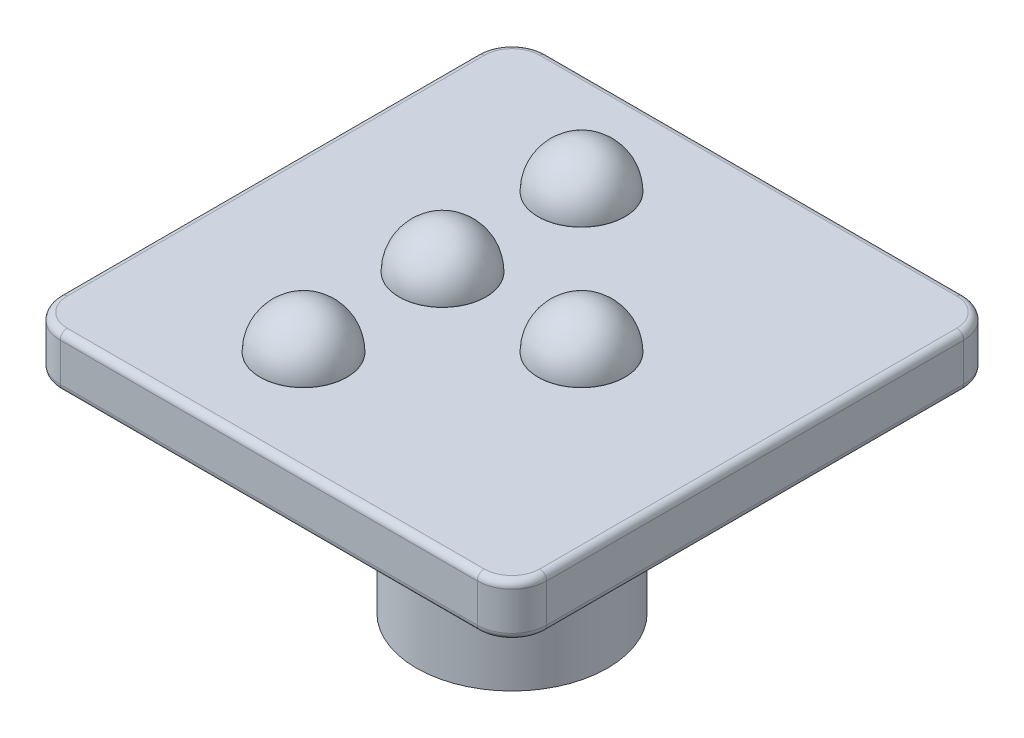
from build123d import *

# Parameters (mm, degrees)
BOSS_EXTRUDE1_DEPTH = 1.5
SKETCH2_R           = 2.75
BOSS_EXTRUDE2_DEPTH = 6
SKETCH3_W           = 1.1
SKETCH3_H           = 1.45
SKETCH3_W_2         = 1.45
SKETCH3_H_2         = 1.1
CUT_EXTRUDE1_DEPTH  = 6
CHAMFER1_SIZE       = 0.3
FILLET1_R           = 1
SKETCH4_R           = 1.25
BOSS_EXTRUDE3_DEPTH = 0.01
DOME1_FACE_RADIUS   = 1.25
DOME1_HEIGHT        = 1.25
DOME3_FACE_RADIUS   = 1.25
DOME3_HEIGHT        = 1.25
DOME4_FACE_RADIUS   = 1.25
DOME4_HEIGHT        = 1.25
DOME5_FACE_RADIUS   = 1.25
DOME5_HEIGHT        = 1.25
FILLET3_R           = 0.2


with BuildPart() as part:
    # Sketch1 → Boss-Extrude1 (new body)
    with BuildSketch(Plane(origin=(0, 0, 0), x_dir=(1, 0, 0), z_dir=(0, 1, 0))):
        with BuildLine():
            Line((-7.324675649, 4.396717546), (4.675324351, 4.396717546))
            ThreePointArc((4.675324351, 4.396717546), (5.382431132, 4.103824327), (5.675324351, 3.396717546))
            Line((5.675324351, 3.396717546), (5.675324351, -8.603282454))
            ThreePointArc((5.675324351, -8.603282454), (5.382431132, -9.310389235), (4.675324351, -9.603282454))
            Line((4.675324351, -9.603282454), (-7.324675649, -9.603282454))
            ThreePointArc((-7.324675649, -9.603282454), (-8.03178243, -9.310389235), (-8.324675649, -8.603282454))
            Line((-8.324675649, -8.603282454), (-8.324675649, 3.396717546))
            ThreePointArc((-8.324675649, 3.396717546), (-8.03178243, 4.103824327), (-7.324675649, 4.396717546))
        make_face()
    extrude(amount=BOSS_EXTRUDE1_DEPTH)

    # Sketch2 → Boss-Extrude2 (add)
    with BuildSketch(Plane.XZ):
        with Locations(Location((-1.324675649, 2.603282454, 0), (0, 0, 270))):
            Circle(SKETCH2_R)
    extrude(amount=BOSS_EXTRUDE2_DEPTH)

    # Sketch3 → Cut-Extrude1 (cut)
    with BuildSketch(Plane.XZ.offset(6)):
        with Locations((-1.324675649, 3.878282454)):
            Rectangle(SKETCH3_W, SKETCH3_H)
        with Locations((-0.049675649, 2.603282454)):
            Rectangle(SKETCH3_W_2, SKETCH3_H_2)
        with Locations((-1.324675649, 2.603282454)):
            Rectangle(SKETCH3_W, SKETCH3_H_2)
        with Locations((-2.599675649, 2.603282454)):
            Rectangle(SKETCH3_W_2, SKETCH3_H_2)
        with Locations((-1.324675649, 1.328282454)):
            Rectangle(SKETCH3_W, SKETCH3_H)
    extrude(amount=-CUT_EXTRUDE1_DEPTH, mode=Mode.SUBTRACT)

    # Chamfer1
    chamfer1_edges = [part.edges().sort_by_distance(p)[0] for p in [
        (-0.774675649, -6, 3.878282454),
        (-0.049675649, -6, 3.153282454),
        (0.675324351, -6, 2.603282454),
        (-0.774675649, -6, 1.328282454),
        (-2.599675649, -6, 3.153282454),
        (-1.324675649, -6, 4.603282454),
        (-1.874675649, -6, 3.878282454),
        (-3.324675649, -6, 2.603282454),
        (-2.599675649, -6, 2.053282454),
        (-1.874675649, -6, 1.328282454),
        (-1.324675649, -6, 0.603282454),
        (-0.049675649, -6, 2.053282454),
    ]]
    chamfer(chamfer1_edges, length=CHAMFER1_SIZE)

    # Fillet1
    fillet1_edges = [part.edges().sort_by_distance(p)[0] for p in [
        (-1.324675649, 0, 5.353282454),
    ]]
    fillet(fillet1_edges, radius=FILLET1_R)

    # Sketch4 → Boss-Extrude3 (add)
    with BuildSketch(Plane(origin=(0, 1.5, 0), x_dir=(1, 0, 0), z_dir=(0, 1, 0))):
        with Locations(Location((-3.324675649, 1.396717546, 0), (0, 0, 90))):
            Circle(SKETCH4_R)
        with Locations(Location((0.675324351, -2.603282454, 0), (0, 0, 90))):
            Circle(SKETCH4_R)
        with Locations(Location((-3.324675649, -2.603282454, 0), (0, 0, 90))):
            Circle(SKETCH4_R)
        with Locations(Location((-3.324675649, -6.603282454, 0), (0, 0, 90))):
            Circle(SKETCH4_R)
    extrude(amount=BOSS_EXTRUDE3_DEPTH)

    # Dome1: a dome of height H over a round flat face of radius A is a cap of a sphere of radius (A * A + H * H) / (2 * H)
    dome1_r = (DOME1_FACE_RADIUS * DOME1_FACE_RADIUS + DOME1_HEIGHT * DOME1_HEIGHT) / (2 * DOME1_HEIGHT)
    dome1_base = Plane((-3.324675649, 1.51, -1.396717546), z_dir=(0, 1, 0))
    with Locations(dome1_base.offset(DOME1_HEIGHT - dome1_r)):
        dome1_ball = Sphere(dome1_r, mode=Mode.PRIVATE)
    add(split(dome1_ball, bisect_by=dome1_base, keep=Keep.TOP, mode=Mode.PRIVATE))

    # Dome3: a dome of height H over a round flat face of radius A is a cap of a sphere of radius (A * A + H * H) / (2 * H)
    dome3_r = (DOME3_FACE_RADIUS * DOME3_FACE_RADIUS + DOME3_HEIGHT * DOME3_HEIGHT) / (2 * DOME3_HEIGHT)
    dome3_base = Plane((-3.324675649, 1.51, 2.603282454), z_dir=(0, 1, 0))
    with Locations(dome3_base.offset(DOME3_HEIGHT - dome3_r)):
        dome3_ball = Sphere(dome3_r, mode=Mode.PRIVATE)
    add(split(dome3_ball, bisect_by=dome3_base, keep=Keep.TOP, mode=Mode.PRIVATE))

    # Dome4: a dome of height H over a round flat face of radius A is a cap of a sphere of radius (A * A + H * H) / (2 * H)
    dome4_r = (DOME4_FACE_RADIUS * DOME4_FACE_RADIUS + DOME4_HEIGHT * DOME4_HEIGHT) / (2 * DOME4_HEIGHT)
    dome4_base = Plane((0.675324351, 1.51, 2.603282454), z_dir=(0, 1, 0))
    with Locations(dome4_base.offset(DOME4_HEIGHT - dome4_r)):
        dome4_ball = Sphere(dome4_r, mode=Mode.PRIVATE)
    add(split(dome4_ball, bisect_by=dome4_base, keep=Keep.TOP, mode=Mode.PRIVATE))

    # Dome5: a dome of height H over a round flat face of radius A is a cap of a sphere of radius (A * A + H * H) / (2 * H)
    dome5_r = (DOME5_FACE_RADIUS * DOME5_FACE_RADIUS + DOME5_HEIGHT * DOME5_HEIGHT) / (2 * DOME5_HEIGHT)
    dome5_base = Plane((-3.324675649, 1.51, 6.603282454), z_dir=(0, 1, 0))
    with Locations(dome5_base.offset(DOME5_HEIGHT - dome5_r)):
        dome5_ball = Sphere(dome5_r, mode=Mode.PRIVATE)
    add(split(dome5_ball, bisect_by=dome5_base, keep=Keep.TOP, mode=Mode.PRIVATE))

    # Fillet3
    fillet3_edges = [part.edges().sort_by_distance(p)[0] for p in [
        (5.382431132, 1.5, 9.310389235),
        (-1.324675649, 0, 9.603282454),
        (-8.03178243, 0, 9.310389235),
        (5.675324351, 1.5, 2.603282454),
        (5.382431132, 1.5, -4.103824327),
        (-1.324675649, 1.5, -4.396717546),
        (-8.03178243, 1.5, -4.103824327),
        (-8.324675649, 1.5, 2.603282454),
        (-8.03178243, 1.5, 9.310389235),
        (-1.324675649, 1.5, 9.603282454),
        (-8.324675649, 0, 2.603282454),
        (-8.03178243, 0, -4.103824327),
        (-1.324675649, 0, -4.396717546),
        (5.382431132, 0, -4.103824327),
        (5.675324351, 0, 2.603282454),
        (5.382431132, 0, 9.310389235),
    ]]
    fillet(fillet3_edges, radius=FILLET3_R)


solid = part.part
